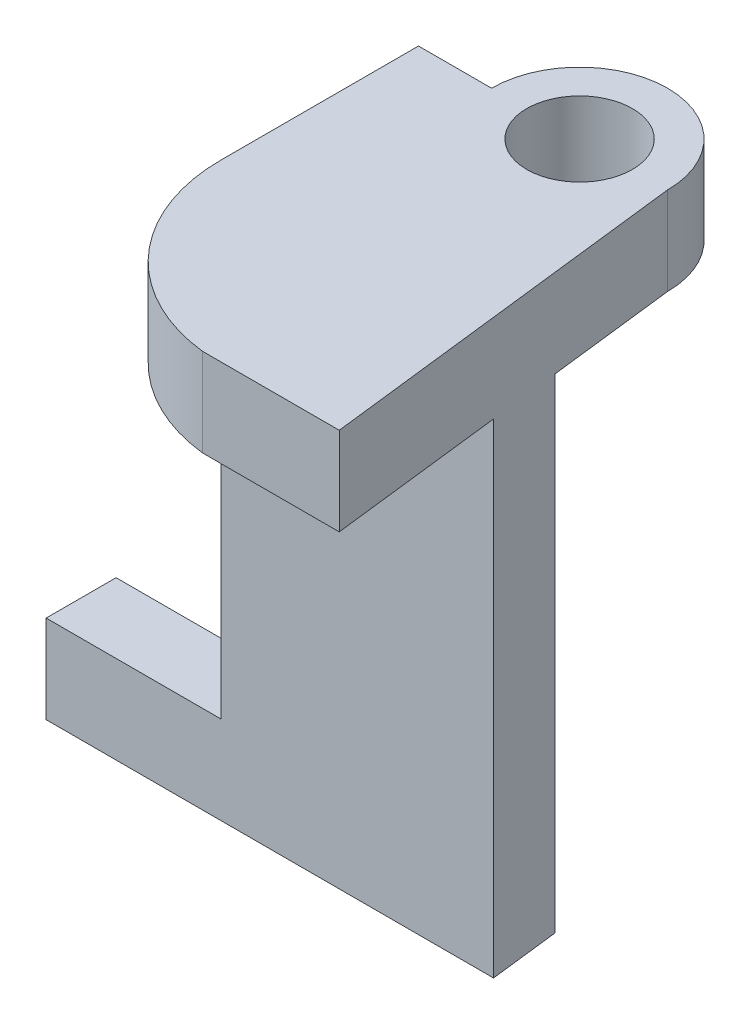
from build123d import *

# Parameters (mm, degrees)
CROQUIS2_R              = 3
SALIENTE_EXTRUIR1_DEPTH = 5
SALIENTE_EXTRUIR2_DEPTH = 22.5
SALIENTE_EXTRUIR3_DEPTH = 5


with BuildPart() as part:
    # Croquis2 → Saliente-Extruir1 (new body)
    with BuildSketch(Plane(origin=(0, 0, 0), x_dir=(1, 0, 0), z_dir=(0, 1, 0))):
        with BuildLine():
            Line((7.5, -21.15), (5, 0))
            ThreePointArc((5, 0), (0, 5), (-5, 0))
            Line((-5, 0), (-9.15, 0))
            Line((-9.15, 0), (-9.15, -11.212351015))
            ThreePointArc((-9.15, -11.212351015), (-6.604850295, -17.877574723), (-0.264958583, -21.15))
            Line((-0.264958583, -21.15), (-0.127201334, -21.15))
            Line((-0.127201334, -21.15), (7.5, -21.15))
        make_face()
        with Locations(Location((0, 0, 0), (0, 0, 270))):
            Circle(CROQUIS2_R, mode=Mode.SUBTRACT)
    extrude(amount=SALIENTE_EXTRUIR1_DEPTH)

    # Croquis3 → Saliente-Extruir2 (add)
    with BuildSketch(Plane.XZ):
        Polygon((-9.15, 11.212351015), (6.325336999, 11.212351015), (5.855792624, 7.240005602), (-9.15, 7.240005602), align=None)
    extrude(amount=SALIENTE_EXTRUIR2_DEPTH)

    # Croquis4 → Saliente-Extruir3 (add)
    with BuildSketch(Plane.XZ.offset(22.5)):
        Polygon((5.855792624, 7.240005602), (6.325336999, 11.212351015), (-19.085175152, 11.212351015), (-19.085175152, 7.240005602), align=None)
    extrude(amount=SALIENTE_EXTRUIR3_DEPTH)


solid = part.part
